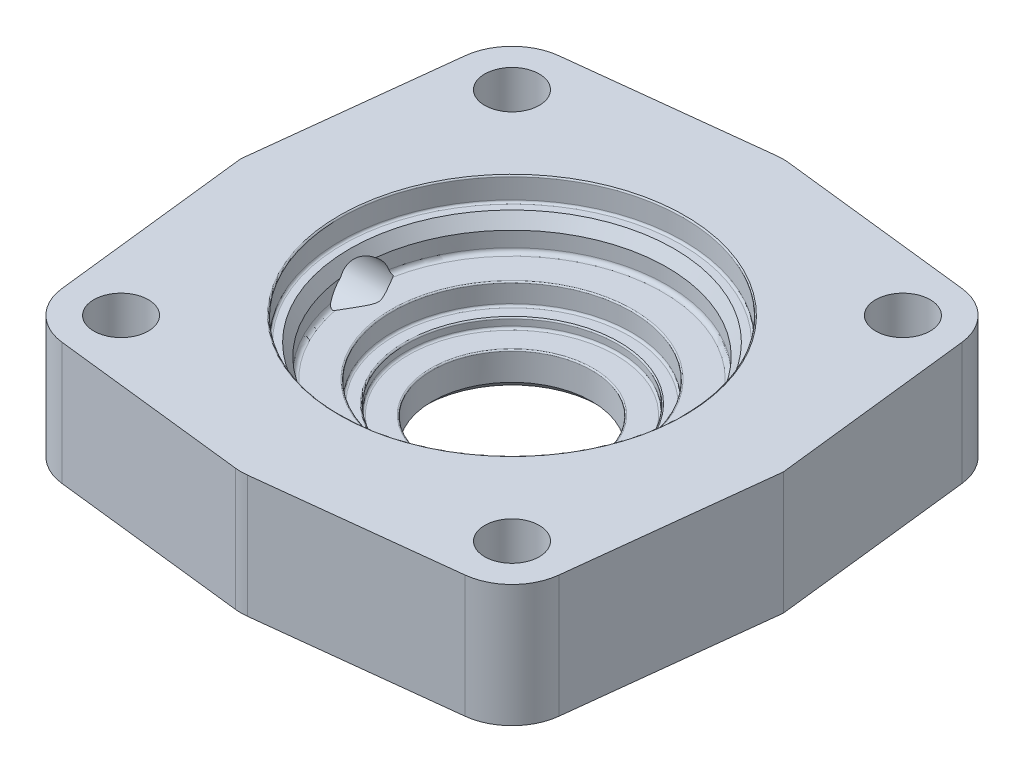
from build123d import *

# Parameters (mm, degrees)
BOSS_EXTRUDE1_DEPTH = 11.5
SKETCH5_R           = 5.125
CUT_EXTRUDE3_DEPTH  = 76.659834992
SKETCH4_R           = 44
SKETCH4_R_2         = 41.45
CUT_EXTRUDE2_DEPTH  = 1.75
FILLET1_R           = 0.25


with BuildPart() as part:
    # Sketch2 → Boss-Extrude1 (new, symmetric)
    with BuildSketch(Plane(origin=(0, 0, 0), x_dir=(1, 0, 0), z_dir=(0, 1, 0))):
        with BuildLine():
            Line((1.131558067, 50.871129935), (37.881558067, 46.685772559))
            ThreePointArc((37.881558067, 46.685772559), (43.821067812, 43.821067812), (46.685772559, 37.881558067))
            Line((46.685772559, 37.881558067), (51, 0))
            Line((51, 0), (46.685772559, -37.881558067))
            ThreePointArc((46.685772559, -37.881558067), (43.821067812, -43.821067812), (37.881558067, -46.685772559))
            Line((37.881558067, -46.685772559), (1.131558067, -50.871129935))
            ThreePointArc((1.131558067, -50.871129935), (0, -50.935357376), (-1.131558067, -50.871129935))
            Line((-1.131558067, -50.871129935), (-37.881558067, -46.685772559))
            ThreePointArc((-37.881558067, -46.685772559), (-43.821067812, -43.821067812), (-46.685772559, -37.881558067))
            Line((-46.685772559, -37.881558067), (-51, 0))
            Line((-51, 0), (-46.685772559, 37.881558067))
            ThreePointArc((-46.685772559, 37.881558067), (-43.821067812, 43.821067812), (-37.881558067, 46.685772559))
            Line((-37.881558067, 46.685772559), (-1.131558067, 50.871129935))
            ThreePointArc((-1.131558067, 50.871129935), (0, 50.935357376), (1.131558067, 50.871129935))
        make_face()
    extrude(amount=BOSS_EXTRUDE1_DEPTH, both=True)

    # Sketch5 → Cut-Extrude3 (cut, through all)
    with BuildSketch(Plane.XZ.offset(11.5)):
        with Locations(Location((-36.75, 36.75, 0), (0, 0, 270))):
            Circle(SKETCH5_R)
        with Locations(Location((36.75, 36.75, 0), (0, 0, 270))):
            Circle(SKETCH5_R)
        with Locations(Location((-36.75, -36.75, 0), (0, 0, 270))):
            Circle(SKETCH5_R)
        with Locations(Location((36.75, -36.75, 0), (0, 0, 270))):
            Circle(SKETCH5_R)
    extrude(amount=-CUT_EXTRUDE3_DEPTH, mode=Mode.SUBTRACT)

    # Sketch4 → Cut-Extrude2 (cut)
    with BuildSketch(Plane.XZ.offset(11.5)):
        with Locations(Location((0, 0, 0), (0, 0, 270))):
            Circle(SKETCH4_R)
        with Locations(Location((0, 0, 0), (0, 0, 270))):
            Circle(SKETCH4_R_2, mode=Mode.SUBTRACT)
    extrude(amount=-CUT_EXTRUDE2_DEPTH, mode=Mode.SUBTRACT)

    # Sketch6 → Cut-Revolve1 (revolve, cut)
    with BuildSketch(Plane(origin=(0, 0, 0), x_dir=(0, 0, -1), z_dir=(1, 0, 0)), mode=Mode.PRIVATE) as cut_revolve1_sk:
        with BuildLine():
            Line((32.25, 11.5), (32.25, 7.5))
            ThreePointArc((32.25, 7.5), (32.132842712, 7.217157288), (31.85, 7.1))
            Line((31.85, 7.1), (30.5, 7.1))
            Line((30.5, 7.1), (29.15, 4.76173141))
            Line((29.15, 4.76173141), (29.15, 1.9))
            ThreePointArc((29.15, 1.9), (28.915685425, 1.334314575), (28.35, 1.1))
            Line((28.35, 1.1), (22.75, 1.1))
            ThreePointArc((22.75, 1.1), (22.573223305, 1.026776695), (22.5, 0.85))
            Line((22.5, 0.85), (22.5, -2.5))
            ThreePointArc((22.5, -2.5), (22.382842712, -2.782842712), (22.1, -2.9))
            Line((22.1, -2.9), (20.15, -2.9))
            ThreePointArc((20.15, -2.9), (19.973223305, -2.973223305), (19.9, -3.15))
            Line((19.9, -3.15), (19.9, -4.3))
            ThreePointArc((19.9, -4.3), (19.782842712, -4.582842712), (19.5, -4.7))
            Line((19.5, -4.7), (15.25, -4.7))
            ThreePointArc((15.25, -4.7), (15.073223305, -4.773223305), (15, -4.95))
            Line((15, -4.95), (15, -10))
            Line((15, -10), (16.5, -11.5))
            Line((16.5, -11.5), (0, -11.5))
            Line((0, -11.5), (0, 11.5))
            Line((0, 11.5), (32.25, 11.5))
        make_face()
    revolve(cut_revolve1_sk.sketch.rotate(Axis((0, 16.721250206, 0), (0, -1, 0)), 180), axis=Axis((0, 16.721250206, 0), (0, -1, 0)), mode=Mode.SUBTRACT)

    # Fillet1
    fillet1_edges = [part.edges().sort_by_distance(p)[0] for p in [
        (0, 11.5, -32.25),
    ]]
    fillet(fillet1_edges, radius=FILLET1_R)

    # Sketch7 → Cut-Revolve2 (revolve, cut)
    with BuildSketch(Plane.XY, mode=Mode.PRIVATE) as cut_revolve2_sk:
        Polygon((-52.009628693, 10), (-49.5, 10), (-49.5, 5.8), (-27.98499159, 5.8), (-24.5, 0), (-52.009628693, 0), align=None)
    revolve(cut_revolve2_sk.sketch.rotate(Axis((-52.009628693, 0, 0), (1, 0, 0)), 90), axis=Axis((-52.009628693, 0, 0), (1, 0, 0)), mode=Mode.SUBTRACT)

    # Sketch9 → Cut-Revolve3 (revolve, cut)
    with BuildSketch(Plane.XY):
        Polygon((26.468244231, 7.953971651), (24.303180721, 6.703971651), (37.448959942, -16.065185865), (39.614023451, -14.815185865), align=None)
    revolve(axis=Axis((26.468244231, 7.953971651, 0), (0.49999999999999484, -0.8660254037844416, 0)), mode=Mode.SUBTRACT)


solid = part.part
